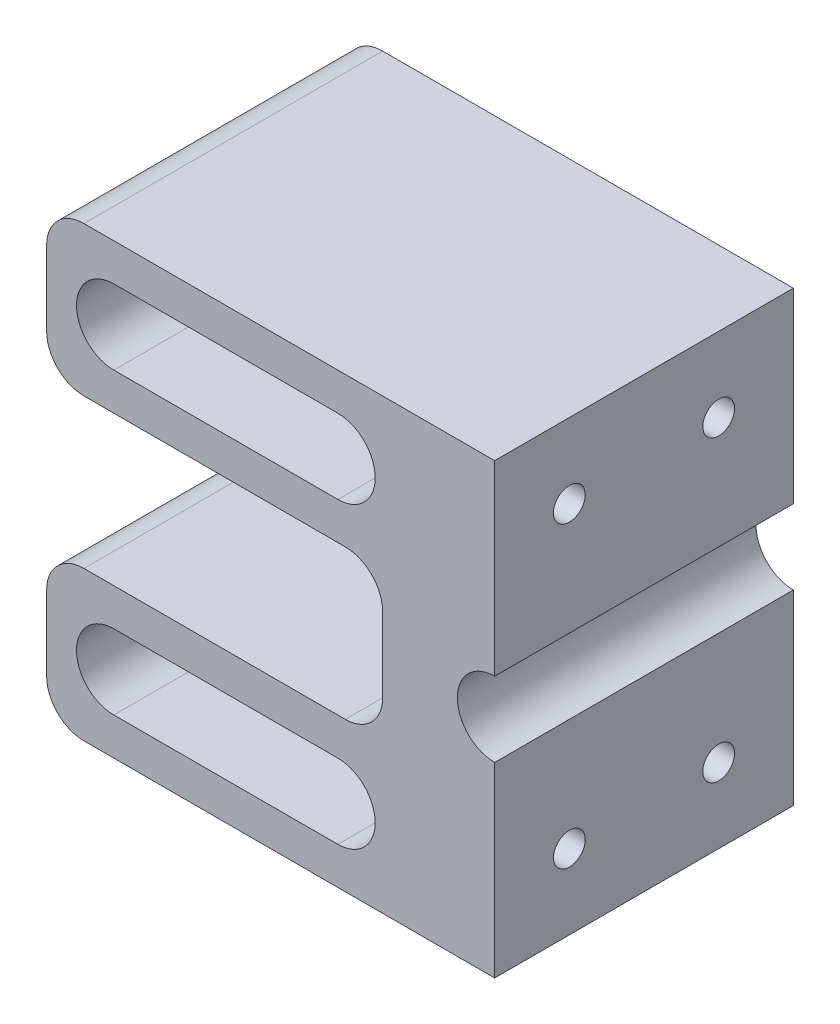
from build123d import *

# Parameters (mm, degrees)
SKETCH1_W                      = 38.1
SKETCH1_H                      = 25.4
BOSS_EXTRUDE1_DEPTH            = 12.7
CUT_EXTRUDE2_REACH             = 36.196
SKETCH7_R                      = 3.175
F_6_32_TAPPED_HOLE1_AT_2_COUNT = 2
F_6_32_TAPPED_HOLE1_AT_2_PITCH = 12.7
CUT_EXTRUDE3_DEPTH             = 25.4
SKETCH14_W                     = 28.575
SKETCH14_H                     = 12.7
CUT_EXTRUDE5_DEPTH             = 25.4
FILLET2_R                      = 3.175
FILLET2_OF_MIRROR1_R           = 3.175
FILLET3_R                      = 3.175


with BuildPart() as part:
    # Sketch1 → Boss-Extrude1 (new, symmetric)
    with BuildSketch(Plane.XY):
        Rectangle(SKETCH1_W, SKETCH1_H)
    boss_extrude1 = extrude(amount=BOSS_EXTRUDE1_DEPTH, both=True)

    # Sketch7 → Cut-Extrude2 (cut, up to next)
    with BuildSketch(Plane.XY.offset(12.7), mode=Mode.PRIVATE) as cut_extrude2_sk1:
        with Locations((19.05, -6.35)):
            Circle(SKETCH7_R)
    cut_extrude2_tool1 = extrude(cut_extrude2_sk1.sketch, amount=-CUT_EXTRUDE2_REACH, mode=Mode.PRIVATE) & part.part
    cut_extrude2 = cut_extrude2_tool1.solids().sort_by_distance((19.05, -6.35, 12.7))[0]
    add(cut_extrude2, mode=Mode.SUBTRACT)

    # Sketch11 → #6-32 Tapped Hole1 (revolve, cut)
    with BuildSketch(Plane(origin=(19.05, 6.35, 6.35), x_dir=(0, 0, -1), z_dir=(0, 1, 0))):
        Polygon((0, 0), (0, 8.89), (1.35255, 8.07730597), (1.35255, 0), align=None)
    f_6_32_tapped_hole1 = revolve(axis=Axis((25.4, 6.35, 6.35), (-1, 0, 0)), mode=Mode.SUBTRACT)

    # #6-32 Tapped Hole1 at 2: #6-32 Tapped Hole1 ×2
    with Locations(*[(0, 0, -i * F_6_32_TAPPED_HOLE1_AT_2_PITCH) for i in range(1, F_6_32_TAPPED_HOLE1_AT_2_COUNT)]):
        add(f_6_32_tapped_hole1, mode=Mode.SUBTRACT)

    # Sketch12 → Cut-Extrude3 (cut)
    with BuildSketch(Plane.XY.offset(12.7)):
        with BuildLine():
            Line((-13.335, 9.525), (5.715, 9.525))
            ThreePointArc((5.715, 9.525), (8.89, 6.35), (5.715, 3.175))
            Line((5.715, 3.175), (-13.335, 3.175))
            ThreePointArc((-13.335, 3.175), (-16.51, 6.35), (-13.335, 9.525))
        make_face()
    cut_extrude3 = extrude(amount=-CUT_EXTRUDE3_DEPTH, mode=Mode.SUBTRACT)

    # Sketch14 → Cut-Extrude5 (cut)
    with BuildSketch(Plane.XY.offset(12.7)):
        with Locations((-4.7625, -6.35)):
            Rectangle(SKETCH14_W, SKETCH14_H)
    cut_extrude5 = extrude(amount=-CUT_EXTRUDE5_DEPTH, mode=Mode.SUBTRACT)

    # Fillet2
    fillet2_edges = [part.edges().sort_by_distance(p)[0] for p in [
        (9.525, 0, 0),
        (-19.05, 0, 0),
        (-19.05, 12.7, 0),
    ]]
    fillet(fillet2_edges, radius=FILLET2_R)

    # Mirror1: Boss-Extrude1, Cut-Extrude2, #6-32 Tapped Hole1, Cut-Extrude3, Cut-Extrude5 across plane
    add(boss_extrude1.mirror(Plane.ZX.offset(-6.35)))
    add(cut_extrude2.mirror(Plane.ZX.offset(-6.35)), mode=Mode.SUBTRACT)
    add(f_6_32_tapped_hole1.mirror(Plane.ZX.offset(-6.35)), mode=Mode.SUBTRACT)
    add(cut_extrude3.mirror(Plane.ZX.offset(-6.35)), mode=Mode.SUBTRACT)
    add(cut_extrude5.mirror(Plane.ZX.offset(-6.35)), mode=Mode.SUBTRACT)

    # Mirror1 copy 1 sketch → Mirror1 copy 1 (revolve, cut)
    with BuildSketch(Plane(origin=(19.05, -19.05, -6.35), x_dir=(0, 0, -1), z_dir=(0, -1, 0))):
        Polygon((0, 0), (0, -8.89), (1.35255, -8.07730597), (1.35255, 0), align=None)
    revolve(axis=Axis((25.4, -19.05, -6.35), (1, 0, 0)), mode=Mode.SUBTRACT)

    # Fillet2 of Mirror1
    fillet2_of_mirror1_edges = [part.edges().sort_by_distance(p)[0] for p in [
        (9.525, -12.7, 0),
        (-19.05, -12.7, 0),
        (-19.05, -25.4, 0),
    ]]
    fillet(fillet2_of_mirror1_edges, radius=FILLET2_OF_MIRROR1_R)

    # Fillet3
    fillet3_edges = [part.edges().sort_by_distance(p)[0] for p in [
        (9.525, 0, 0),
    ]]
    fillet(fillet3_edges, radius=FILLET3_R)


solid = part.part
